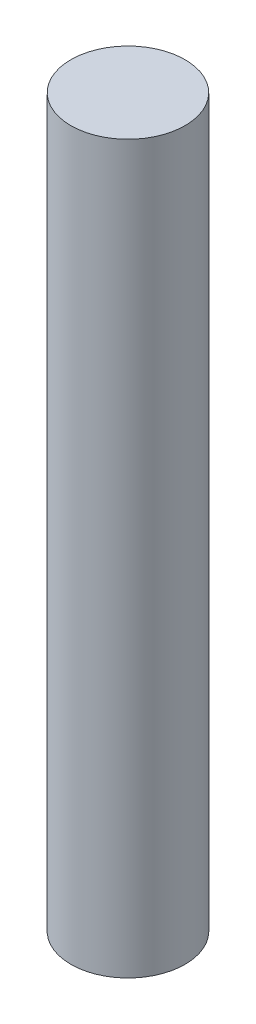
from build123d import *

# Parameters (mm, degrees)
SKETCH1_R           = 3.175
BOSS_EXTRUDE1_DEPTH = 40.36463


with BuildPart() as part:
    # Sketch1 → Boss-Extrude1 (new body)
    with BuildSketch(Plane(origin=(0, 0, 0), x_dir=(1, 0, 0), z_dir=(0, 1, 0))):
        with Locations(Location((0, 0, 0), (0, 0, 270))):
            Circle(SKETCH1_R)
    extrude(amount=BOSS_EXTRUDE1_DEPTH)


solid = part.part
